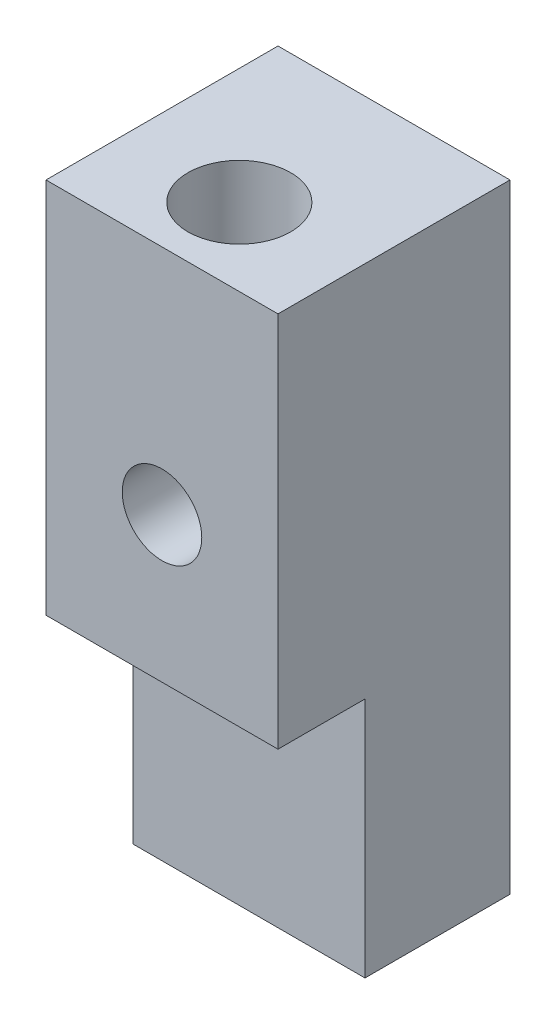
from build123d import *

# Parameters (mm, degrees)
EXTRUDE1_DEPTH              = 19.05
F_5_16_18_TAPPED_HOLE1_D    = 6.5278
F_3_8_24_TAPPED_HOLE1_D     = 8.4328
F_3_8_24_TAPPED_HOLE1_DEPTH = 12.7
F_3_8_24_TAPPED_HOLE1_TIP   = 2.533468714


with BuildPart() as part:
    # Sketch1 → Extrude1 (new body)
    with BuildSketch(Plane(origin=(0, 0, 0), x_dir=(0, 0, -1), z_dir=(1, 0, 0))):
        Polygon((0, 0), (11.90625, 0), (11.90625, 50.8), (-7.14375, 50.8), (-7.14375, 19.84375), (0, 19.84375), align=None)
    extrude(amount=EXTRUDE1_DEPTH)

    # 5/16-18 Tapped Hole1 (through all)
    with Locations(Plane.XY.offset(7.14375)):
        with Locations((9.525, 31.75)):
            Hole(F_5_16_18_TAPPED_HOLE1_D / 2)

    # 3/8-24 Tapped Hole1
    with Locations(Plane(origin=(0, 50.8, 0), x_dir=(-1, 0, 0), z_dir=(0, 1, 0))):
        with Locations((-9.525, 0.79375)):
            Hole(F_3_8_24_TAPPED_HOLE1_D / 2, depth=F_3_8_24_TAPPED_HOLE1_DEPTH)
            with Locations((0, 0, -(F_3_8_24_TAPPED_HOLE1_DEPTH + F_3_8_24_TAPPED_HOLE1_TIP / 2))):  # 118° drill point
                Cone(0, F_3_8_24_TAPPED_HOLE1_D / 2, F_3_8_24_TAPPED_HOLE1_TIP, mode=Mode.SUBTRACT)


solid = part.part
